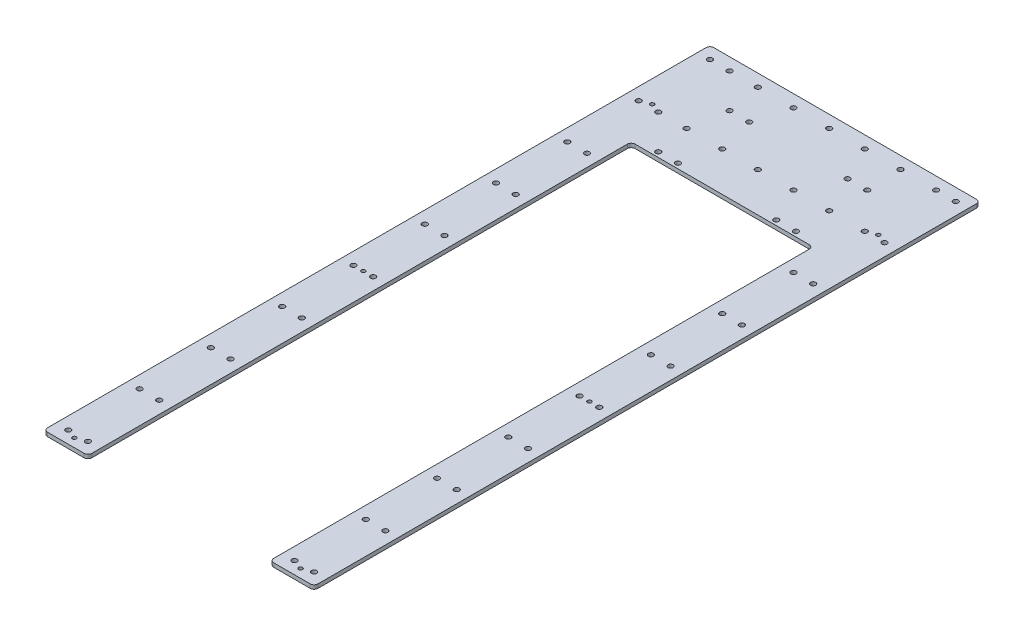
from build123d import *

# Parameters (mm, degrees)
SKETCH1_R           = 2.1
SKETCH1_R_2         = 1.6
BOSS_EXTRUDE1_DEPTH = 3.175
FILLET1_R           = 3.2


with BuildPart() as part:
    # Sketch1 → Boss-Extrude1 (new body)
    with BuildSketch(Plane(origin=(0, 0, 0), x_dir=(1, 0, 0), z_dir=(0, 1, 0))):
        Polygon((-110, -271), (-74, -271), (-74, 171), (74, 171), (74, -271), (110, -271), (110, 271), (-110, 271), align=None)
        with Locations(Location((100, 261, 0), (0, 0, 270))):
            Circle(SKETCH1_R, mode=Mode.SUBTRACT)
        with Locations(Location((100, 203, 0), (0, 0, 270))):
            Circle(SKETCH1_R, mode=Mode.SUBTRACT)
        with Locations(Location((100, 145, 0), (0, 0, 270))):
            Circle(SKETCH1_R, mode=Mode.SUBTRACT)
        with Locations(Location((100, 87, 0), (0, 0, 270))):
            Circle(SKETCH1_R, mode=Mode.SUBTRACT)
        with Locations(Location((100, 29, 0), (0, 0, 270))):
            Circle(SKETCH1_R, mode=Mode.SUBTRACT)
        with Locations(Location((100, -29, 0), (0, 0, 270))):
            Circle(SKETCH1_R, mode=Mode.SUBTRACT)
        with Locations(Location((100, -87, 0), (0, 0, 270))):
            Circle(SKETCH1_R, mode=Mode.SUBTRACT)
        with Locations(Location((100, -145, 0), (0, 0, 270))):
            Circle(SKETCH1_R, mode=Mode.SUBTRACT)
        with Locations(Location((100, -203, 0), (0, 0, 270))):
            Circle(SKETCH1_R, mode=Mode.SUBTRACT)
        with Locations(Location((100, -261, 0), (0, 0, 270))):
            Circle(SKETCH1_R, mode=Mode.SUBTRACT)
        with Locations(Location((84, -261, 0), (0, 0, 270))):
            Circle(SKETCH1_R, mode=Mode.SUBTRACT)
        with Locations(Location((84, -203, 0), (0, 0, 270))):
            Circle(SKETCH1_R, mode=Mode.SUBTRACT)
        with Locations(Location((84, -145, 0), (0, 0, 270))):
            Circle(SKETCH1_R, mode=Mode.SUBTRACT)
        with Locations(Location((84, -87, 0), (0, 0, 270))):
            Circle(SKETCH1_R, mode=Mode.SUBTRACT)
        with Locations(Location((84, -29, 0), (0, 0, 270))):
            Circle(SKETCH1_R, mode=Mode.SUBTRACT)
        with Locations(Location((84, 29, 0), (0, 0, 270))):
            Circle(SKETCH1_R, mode=Mode.SUBTRACT)
        with Locations(Location((84, 87, 0), (0, 0, 270))):
            Circle(SKETCH1_R, mode=Mode.SUBTRACT)
        with Locations(Location((84, 145, 0), (0, 0, 270))):
            Circle(SKETCH1_R, mode=Mode.SUBTRACT)
        with Locations(Location((84, 203, 0), (0, 0, 270))):
            Circle(SKETCH1_R, mode=Mode.SUBTRACT)
        with Locations(Location((84, 261, 0), (0, 0, 270))):
            Circle(SKETCH1_R, mode=Mode.SUBTRACT)
        with Locations(Location((92, -29, 0), (0, 0, 270))):
            Circle(SKETCH1_R_2, mode=Mode.SUBTRACT)
        with Locations(Location((92, 206, 0), (0, 0, 270))):
            Circle(SKETCH1_R_2, mode=Mode.SUBTRACT)
        with Locations(Location((92, -264, 0), (0, 0, 270))):
            Circle(SKETCH1_R_2, mode=Mode.SUBTRACT)
        with Locations(Location((-100, 261, 0), (0, 0, 270))):
            Circle(SKETCH1_R, mode=Mode.SUBTRACT)
        with Locations(Location((-84, 261, 0), (0, 0, 270))):
            Circle(SKETCH1_R, mode=Mode.SUBTRACT)
        with Locations(Location((-92, 206, 0), (0, 0, 270))):
            Circle(SKETCH1_R_2, mode=Mode.SUBTRACT)
        with Locations(Location((-84, 87, 0), (0, 0, 270))):
            Circle(SKETCH1_R, mode=Mode.SUBTRACT)
        with Locations(Location((-100, 87, 0), (0, 0, 270))):
            Circle(SKETCH1_R, mode=Mode.SUBTRACT)
        with Locations(Location((-100, 145, 0), (0, 0, 270))):
            Circle(SKETCH1_R, mode=Mode.SUBTRACT)
        with Locations(Location((-100, 203, 0), (0, 0, 270))):
            Circle(SKETCH1_R, mode=Mode.SUBTRACT)
        with Locations(Location((-92, -264, 0), (0, 0, 270))):
            Circle(SKETCH1_R_2, mode=Mode.SUBTRACT)
        with Locations(Location((-92, -29, 0), (0, 0, 270))):
            Circle(SKETCH1_R_2, mode=Mode.SUBTRACT)
        with Locations(Location((-84, 29, 0), (0, 0, 270))):
            Circle(SKETCH1_R, mode=Mode.SUBTRACT)
        with Locations(Location((-84, -29, 0), (0, 0, 270))):
            Circle(SKETCH1_R, mode=Mode.SUBTRACT)
        with Locations(Location((-84, -87, 0), (0, 0, 270))):
            Circle(SKETCH1_R, mode=Mode.SUBTRACT)
        with Locations(Location((-84, -145, 0), (0, 0, 270))):
            Circle(SKETCH1_R, mode=Mode.SUBTRACT)
        with Locations(Location((-84, -203, 0), (0, 0, 270))):
            Circle(SKETCH1_R, mode=Mode.SUBTRACT)
        with Locations(Location((-84, -261, 0), (0, 0, 270))):
            Circle(SKETCH1_R, mode=Mode.SUBTRACT)
        with Locations(Location((-100, -261, 0), (0, 0, 270))):
            Circle(SKETCH1_R, mode=Mode.SUBTRACT)
        with Locations(Location((-100, -203, 0), (0, 0, 270))):
            Circle(SKETCH1_R, mode=Mode.SUBTRACT)
        with Locations(Location((-100, -145, 0), (0, 0, 270))):
            Circle(SKETCH1_R, mode=Mode.SUBTRACT)
        with Locations(Location((-100, -87, 0), (0, 0, 270))):
            Circle(SKETCH1_R, mode=Mode.SUBTRACT)
        with Locations(Location((-100, -29, 0), (0, 0, 270))):
            Circle(SKETCH1_R, mode=Mode.SUBTRACT)
        with Locations(Location((-100, 29, 0), (0, 0, 270))):
            Circle(SKETCH1_R, mode=Mode.SUBTRACT)
        with Locations(Location((-84, 203, 0), (0, 0, 270))):
            Circle(SKETCH1_R, mode=Mode.SUBTRACT)
        with Locations(Location((-84, 145, 0), (0, 0, 270))):
            Circle(SKETCH1_R, mode=Mode.SUBTRACT)
        with Locations(Location((55, 261, 0), (0, 0, 270))):
            Circle(SKETCH1_R, mode=Mode.SUBTRACT)
        with Locations(Location((26, 261, 0), (0, 0, 270))):
            Circle(SKETCH1_R, mode=Mode.SUBTRACT)
        with Locations(Location((-3, 261, 0), (0, 0, 270))):
            Circle(SKETCH1_R, mode=Mode.SUBTRACT)
        with Locations(Location((-32, 261, 0), (0, 0, 270))):
            Circle(SKETCH1_R, mode=Mode.SUBTRACT)
        with Locations(Location((-61, 261, 0), (0, 0, 270))):
            Circle(SKETCH1_R, mode=Mode.SUBTRACT)
        with Locations(Location((55, 203, 0), (0, 0, 270))):
            Circle(SKETCH1_R, mode=Mode.SUBTRACT)
        with Locations(Location((26, 203, 0), (0, 0, 270))):
            Circle(SKETCH1_R, mode=Mode.SUBTRACT)
        with Locations(Location((-3, 203, 0), (0, 0, 270))):
            Circle(SKETCH1_R, mode=Mode.SUBTRACT)
        with Locations(Location((-32, 203, 0), (0, 0, 270))):
            Circle(SKETCH1_R, mode=Mode.SUBTRACT)
        with Locations(Location((-61, 203, 0), (0, 0, 270))):
            Circle(SKETCH1_R, mode=Mode.SUBTRACT)
        with Locations(Location((-56, 175, 0), (0, 0, 270))):
            Circle(SKETCH1_R, mode=Mode.SUBTRACT)
        with Locations(Location((-40, 175, 0), (0, 0, 270))):
            Circle(SKETCH1_R, mode=Mode.SUBTRACT)
        with Locations(Location((-40, 233, 0), (0, 0, 270))):
            Circle(SKETCH1_R, mode=Mode.SUBTRACT)
        with Locations(Location((-56, 233, 0), (0, 0, 270))):
            Circle(SKETCH1_R, mode=Mode.SUBTRACT)
        with Locations(Location((40, 175, 0), (0, 0, 270))):
            Circle(SKETCH1_R, mode=Mode.SUBTRACT)
        with Locations(Location((56, 175, 0), (0, 0, 270))):
            Circle(SKETCH1_R, mode=Mode.SUBTRACT)
        with Locations(Location((56, 233, 0), (0, 0, 270))):
            Circle(SKETCH1_R, mode=Mode.SUBTRACT)
        with Locations(Location((40, 233, 0), (0, 0, 270))):
            Circle(SKETCH1_R, mode=Mode.SUBTRACT)
    extrude(amount=BOSS_EXTRUDE1_DEPTH)

    # Fillet1
    fillet1_edges = [part.edges().sort_by_distance(p)[0] for p in [
        (74, 1.5875, -171),
        (-74, 1.5875, -171),
        (-74, 1.5875, 271),
        (-110, 1.5875, 271),
        (-110, 1.5875, -271),
        (110, 1.5875, -271),
        (110, 1.5875, 271),
        (74, 1.5875, 271),
    ]]
    fillet(fillet1_edges, radius=FILLET1_R)


solid = part.part
